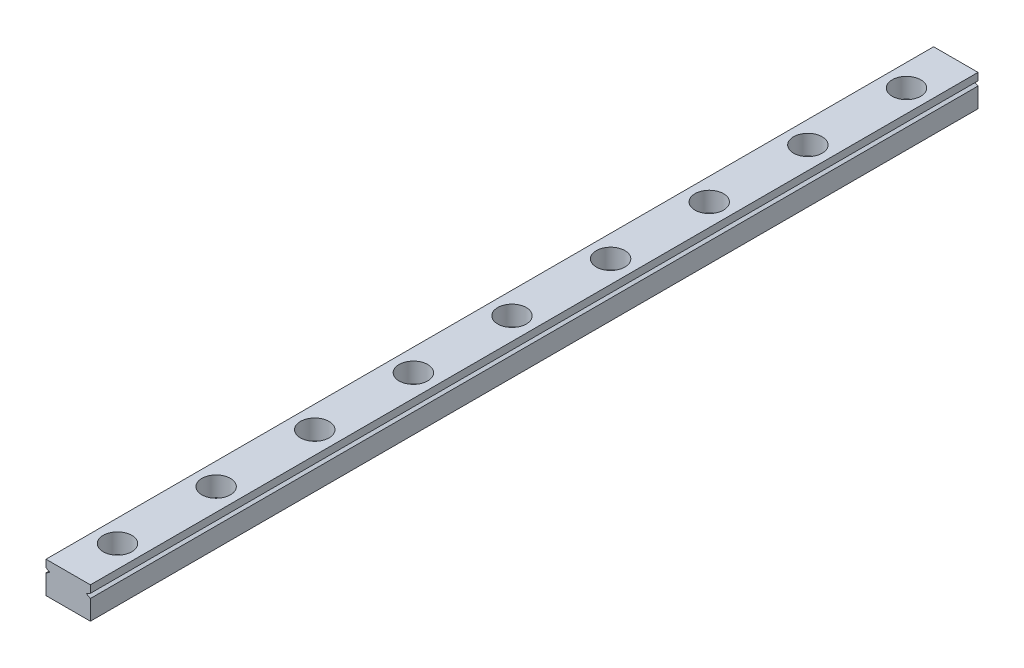
from build123d import *

# Parameters (mm, degrees)
BOSS_EXTRUDE1_DEPTH = 180
SKETCH2_R           = 2.9
CUT_EXTRUDE1_DEPTH  = 4
SKETCH3_R           = 1.7
CUT_EXTRUDE2_DEPTH  = 181.269243078


with BuildPart() as part:
    # Sketch1 → Boss-Extrude1 (new body)
    with BuildSketch(Plane.XY):
        Polygon((9, 6.4), (9, 4.9), (8.2, 4.45), (9, 4), (9, 0), (0, 0), (0, 4), (0.8, 4.45), (0, 4.9), (0, 6.4), align=None)
    extrude(amount=BOSS_EXTRUDE1_DEPTH)

    # Sketch2 → Cut-Extrude1 (cut)
    with BuildSketch(Plane(origin=(0, 6.4, 0), x_dir=(1, 0, 0), z_dir=(0, 1, 0))):
        with Locations(Location((4.5, -170, 0), (0, 0, 270))):
            Circle(SKETCH2_R)
        with Locations(Location((4.5, -150, 0), (0, 0, 270))):
            Circle(SKETCH2_R)
        with Locations(Location((4.5, -130, 0), (0, 0, 270))):
            Circle(SKETCH2_R)
        with Locations(Location((4.5, -110, 0), (0, 0, 270))):
            Circle(SKETCH2_R)
        with Locations(Location((4.5, -90, 0), (0, 0, 270))):
            Circle(SKETCH2_R)
        with Locations(Location((4.5, -70, 0), (0, 0, 270))):
            Circle(SKETCH2_R)
        with Locations(Location((4.5, -50, 0), (0, 0, 270))):
            Circle(SKETCH2_R)
        with Locations(Location((4.5, -30, 0), (0, 0, 270))):
            Circle(SKETCH2_R)
        with Locations(Location((4.5, -10, 0), (0, 0, 270))):
            Circle(SKETCH2_R)
    extrude(amount=-CUT_EXTRUDE1_DEPTH, mode=Mode.SUBTRACT)

    # Sketch3 → Cut-Extrude2 (cut, through all)
    with BuildSketch(Plane(origin=(0, 2.4, 0), x_dir=(1, 0, 0), z_dir=(0, 1, 0))):
        with Locations(Location((4.5, -170, 0), (0, 0, 270))):
            Circle(SKETCH3_R)
        with Locations(Location((4.5, -150, 0), (0, 0, 270))):
            Circle(SKETCH3_R)
        with Locations(Location((4.5, -130, 0), (0, 0, 270))):
            Circle(SKETCH3_R)
        with Locations(Location((4.5, -110, 0), (0, 0, 270))):
            Circle(SKETCH3_R)
        with Locations(Location((4.5, -90, 0), (0, 0, 270))):
            Circle(SKETCH3_R)
        with Locations(Location((4.5, -70, 0), (0, 0, 270))):
            Circle(SKETCH3_R)
        with Locations(Location((4.5, -50, 0), (0, 0, 270))):
            Circle(SKETCH3_R)
        with Locations(Location((4.5, -30, 0), (0, 0, 270))):
            Circle(SKETCH3_R)
        with Locations(Location((4.5, -10, 0), (0, 0, 270))):
            Circle(SKETCH3_R)
    extrude(amount=-CUT_EXTRUDE2_DEPTH, mode=Mode.SUBTRACT)


solid = part.part
